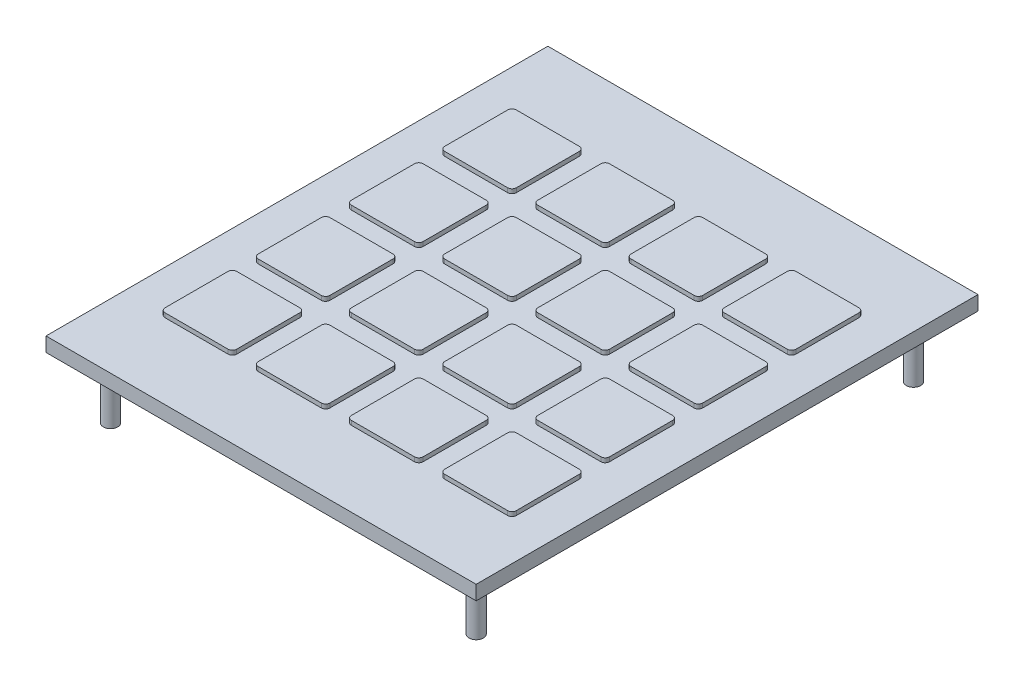
from build123d import *

# Parameters (mm, degrees)
SKETCH1_W           = 60
SKETCH1_H           = 70
BOSS_EXTRUDE1_DEPTH = 2
BOSS_EXTRUDE2_DEPTH = 0.6
SKETCH3_R           = 1
BOSS_EXTRUDE3_DEPTH = 8.5


with BuildPart() as part:
    # Sketch1 → Boss-Extrude1 (new body)
    with BuildSketch(Plane(origin=(0, 0, 0), x_dir=(1, 0, 0), z_dir=(0, 1, 0))):
        with Locations((0.12195122, -20.182926829)):
            Rectangle(SKETCH1_W, SKETCH1_H)
    extrude(amount=BOSS_EXTRUDE1_DEPTH)

    # Sketch2 → Boss-Extrude2 (add)
    with BuildSketch(Plane(origin=(0, 2, 0), x_dir=(1, 0, 0), z_dir=(0, 1, 0))):
        with BuildLine():
            Line((-23.77804878, 4.317073171), (-14.97804878, 4.317073171))
            ThreePointArc((-14.97804878, 4.317073171), (-14.553784712, 4.141337239), (-14.37804878, 3.717073171))
            Line((-14.37804878, 3.717073171), (-14.37804878, -5.082926829))
            ThreePointArc((-14.37804878, -5.082926829), (-14.553784712, -5.507190898), (-14.97804878, -5.682926829))
            Line((-14.97804878, -5.682926829), (-23.77804878, -5.682926829))
            ThreePointArc((-23.77804878, -5.682926829), (-24.202312849, -5.507190898), (-24.37804878, -5.082926829))
            Line((-24.37804878, -5.082926829), (-24.37804878, 3.717073171))
            ThreePointArc((-24.37804878, 3.717073171), (-24.202312849, 4.141337239), (-23.77804878, 4.317073171))
        make_face()
        with BuildLine():
            Line((-10.77804878, 4.317073171), (-1.97804878, 4.317073171))
            ThreePointArc((-1.97804878, 4.317073171), (-1.553784712, 4.141337239), (-1.37804878, 3.717073171))
            Line((-1.37804878, 3.717073171), (-1.37804878, -5.082926829))
            ThreePointArc((-1.37804878, -5.082926829), (-1.553784712, -5.507190898), (-1.97804878, -5.682926829))
            Line((-1.97804878, -5.682926829), (-10.77804878, -5.682926829))
            ThreePointArc((-10.77804878, -5.682926829), (-11.202312849, -5.507190898), (-11.37804878, -5.082926829))
            Line((-11.37804878, -5.082926829), (-11.37804878, 3.717073171))
            ThreePointArc((-11.37804878, 3.717073171), (-11.202312849, 4.141337239), (-10.77804878, 4.317073171))
        make_face()
        with BuildLine():
            Line((2.22195122, 4.317073171), (11.02195122, 4.317073171))
            ThreePointArc((11.02195122, 4.317073171), (11.446215288, 4.141337239), (11.62195122, 3.717073171))
            Line((11.62195122, 3.717073171), (11.62195122, -5.082926829))
            ThreePointArc((11.62195122, -5.082926829), (11.446215288, -5.507190898), (11.02195122, -5.682926829))
            Line((11.02195122, -5.682926829), (2.22195122, -5.682926829))
            ThreePointArc((2.22195122, -5.682926829), (1.797687151, -5.507190898), (1.62195122, -5.082926829))
            Line((1.62195122, -5.082926829), (1.62195122, 3.717073171))
            ThreePointArc((1.62195122, 3.717073171), (1.797687151, 4.141337239), (2.22195122, 4.317073171))
        make_face()
        with BuildLine():
            Line((15.22195122, 4.317073171), (24.02195122, 4.317073171))
            ThreePointArc((24.02195122, 4.317073171), (24.446215288, 4.141337239), (24.62195122, 3.717073171))
            Line((24.62195122, 3.717073171), (24.62195122, -5.082926829))
            ThreePointArc((24.62195122, -5.082926829), (24.446215288, -5.507190898), (24.02195122, -5.682926829))
            Line((24.02195122, -5.682926829), (15.22195122, -5.682926829))
            ThreePointArc((15.22195122, -5.682926829), (14.797687151, -5.507190898), (14.62195122, -5.082926829))
            Line((14.62195122, -5.082926829), (14.62195122, 3.717073171))
            ThreePointArc((14.62195122, 3.717073171), (14.797687151, 4.141337239), (15.22195122, 4.317073171))
        make_face()
        with BuildLine():
            Line((-10.77804878, -8.682926829), (-1.97804878, -8.682926829))
            ThreePointArc((-1.97804878, -8.682926829), (-1.553784712, -8.858662761), (-1.37804878, -9.282926829))
            Line((-1.37804878, -9.282926829), (-1.37804878, -18.082926829))
            ThreePointArc((-1.37804878, -18.082926829), (-1.553784712, -18.507190898), (-1.97804878, -18.682926829))
            Line((-1.97804878, -18.682926829), (-10.77804878, -18.682926829))
            ThreePointArc((-10.77804878, -18.682926829), (-11.202312849, -18.507190898), (-11.37804878, -18.082926829))
            Line((-11.37804878, -18.082926829), (-11.37804878, -9.282926829))
            ThreePointArc((-11.37804878, -9.282926829), (-11.202312849, -8.858662761), (-10.77804878, -8.682926829))
        make_face()
        with BuildLine():
            Line((2.22195122, -8.682926829), (11.02195122, -8.682926829))
            ThreePointArc((11.02195122, -8.682926829), (11.446215288, -8.858662761), (11.62195122, -9.282926829))
            Line((11.62195122, -9.282926829), (11.62195122, -18.082926829))
            ThreePointArc((11.62195122, -18.082926829), (11.446215288, -18.507190898), (11.02195122, -18.682926829))
            Line((11.02195122, -18.682926829), (2.22195122, -18.682926829))
            ThreePointArc((2.22195122, -18.682926829), (1.797687151, -18.507190898), (1.62195122, -18.082926829))
            Line((1.62195122, -18.082926829), (1.62195122, -9.282926829))
            ThreePointArc((1.62195122, -9.282926829), (1.797687151, -8.858662761), (2.22195122, -8.682926829))
        make_face()
        with BuildLine():
            Line((15.22195122, -8.682926829), (24.02195122, -8.682926829))
            ThreePointArc((24.02195122, -8.682926829), (24.446215288, -8.858662761), (24.62195122, -9.282926829))
            Line((24.62195122, -9.282926829), (24.62195122, -18.082926829))
            ThreePointArc((24.62195122, -18.082926829), (24.446215288, -18.507190898), (24.02195122, -18.682926829))
            Line((24.02195122, -18.682926829), (15.22195122, -18.682926829))
            ThreePointArc((15.22195122, -18.682926829), (14.797687151, -18.507190898), (14.62195122, -18.082926829))
            Line((14.62195122, -18.082926829), (14.62195122, -9.282926829))
            ThreePointArc((14.62195122, -9.282926829), (14.797687151, -8.858662761), (15.22195122, -8.682926829))
        make_face()
        with BuildLine():
            Line((-10.77804878, -21.682926829), (-1.97804878, -21.682926829))
            ThreePointArc((-1.97804878, -21.682926829), (-1.553784712, -21.858662761), (-1.37804878, -22.282926829))
            Line((-1.37804878, -22.282926829), (-1.37804878, -31.082926829))
            ThreePointArc((-1.37804878, -31.082926829), (-1.553784712, -31.507190898), (-1.97804878, -31.682926829))
            Line((-1.97804878, -31.682926829), (-10.77804878, -31.682926829))
            ThreePointArc((-10.77804878, -31.682926829), (-11.202312849, -31.507190898), (-11.37804878, -31.082926829))
            Line((-11.37804878, -31.082926829), (-11.37804878, -22.282926829))
            ThreePointArc((-11.37804878, -22.282926829), (-11.202312849, -21.858662761), (-10.77804878, -21.682926829))
        make_face()
        with BuildLine():
            Line((2.22195122, -21.682926829), (11.02195122, -21.682926829))
            ThreePointArc((11.02195122, -21.682926829), (11.446215288, -21.858662761), (11.62195122, -22.282926829))
            Line((11.62195122, -22.282926829), (11.62195122, -31.082926829))
            ThreePointArc((11.62195122, -31.082926829), (11.446215288, -31.507190898), (11.02195122, -31.682926829))
            Line((11.02195122, -31.682926829), (2.22195122, -31.682926829))
            ThreePointArc((2.22195122, -31.682926829), (1.797687151, -31.507190898), (1.62195122, -31.082926829))
            Line((1.62195122, -31.082926829), (1.62195122, -22.282926829))
            ThreePointArc((1.62195122, -22.282926829), (1.797687151, -21.858662761), (2.22195122, -21.682926829))
        make_face()
        with BuildLine():
            Line((15.22195122, -21.682926829), (24.02195122, -21.682926829))
            ThreePointArc((24.02195122, -21.682926829), (24.446215288, -21.858662761), (24.62195122, -22.282926829))
            Line((24.62195122, -22.282926829), (24.62195122, -31.082926829))
            ThreePointArc((24.62195122, -31.082926829), (24.446215288, -31.507190898), (24.02195122, -31.682926829))
            Line((24.02195122, -31.682926829), (15.22195122, -31.682926829))
            ThreePointArc((15.22195122, -31.682926829), (14.797687151, -31.507190898), (14.62195122, -31.082926829))
            Line((14.62195122, -31.082926829), (14.62195122, -22.282926829))
            ThreePointArc((14.62195122, -22.282926829), (14.797687151, -21.858662761), (15.22195122, -21.682926829))
        make_face()
        with BuildLine():
            Line((-10.77804878, -34.682926829), (-1.97804878, -34.682926829))
            ThreePointArc((-1.97804878, -34.682926829), (-1.553784712, -34.858662761), (-1.37804878, -35.282926829))
            Line((-1.37804878, -35.282926829), (-1.37804878, -44.082926829))
            ThreePointArc((-1.37804878, -44.082926829), (-1.553784712, -44.507190898), (-1.97804878, -44.682926829))
            Line((-1.97804878, -44.682926829), (-10.77804878, -44.682926829))
            ThreePointArc((-10.77804878, -44.682926829), (-11.202312849, -44.507190898), (-11.37804878, -44.082926829))
            Line((-11.37804878, -44.082926829), (-11.37804878, -35.282926829))
            ThreePointArc((-11.37804878, -35.282926829), (-11.202312849, -34.858662761), (-10.77804878, -34.682926829))
        make_face()
        with BuildLine():
            Line((2.22195122, -34.682926829), (11.02195122, -34.682926829))
            ThreePointArc((11.02195122, -34.682926829), (11.446215288, -34.858662761), (11.62195122, -35.282926829))
            Line((11.62195122, -35.282926829), (11.62195122, -44.082926829))
            ThreePointArc((11.62195122, -44.082926829), (11.446215288, -44.507190898), (11.02195122, -44.682926829))
            Line((11.02195122, -44.682926829), (2.22195122, -44.682926829))
            ThreePointArc((2.22195122, -44.682926829), (1.797687151, -44.507190898), (1.62195122, -44.082926829))
            Line((1.62195122, -44.082926829), (1.62195122, -35.282926829))
            ThreePointArc((1.62195122, -35.282926829), (1.797687151, -34.858662761), (2.22195122, -34.682926829))
        make_face()
        with BuildLine():
            Line((15.22195122, -34.682926829), (24.02195122, -34.682926829))
            ThreePointArc((24.02195122, -34.682926829), (24.446215288, -34.858662761), (24.62195122, -35.282926829))
            Line((24.62195122, -35.282926829), (24.62195122, -44.082926829))
            ThreePointArc((24.62195122, -44.082926829), (24.446215288, -44.507190898), (24.02195122, -44.682926829))
            Line((24.02195122, -44.682926829), (15.22195122, -44.682926829))
            ThreePointArc((15.22195122, -44.682926829), (14.797687151, -44.507190898), (14.62195122, -44.082926829))
            Line((14.62195122, -44.082926829), (14.62195122, -35.282926829))
            ThreePointArc((14.62195122, -35.282926829), (14.797687151, -34.858662761), (15.22195122, -34.682926829))
        make_face()
        with BuildLine():
            Line((-23.77804878, -8.682926829), (-14.97804878, -8.682926829))
            ThreePointArc((-14.97804878, -8.682926829), (-14.553784712, -8.858662761), (-14.37804878, -9.282926829))
            Line((-14.37804878, -9.282926829), (-14.37804878, -18.082926829))
            ThreePointArc((-14.37804878, -18.082926829), (-14.553784712, -18.507190898), (-14.97804878, -18.682926829))
            Line((-14.97804878, -18.682926829), (-23.77804878, -18.682926829))
            ThreePointArc((-23.77804878, -18.682926829), (-24.202312849, -18.507190898), (-24.37804878, -18.082926829))
            Line((-24.37804878, -18.082926829), (-24.37804878, -9.282926829))
            ThreePointArc((-24.37804878, -9.282926829), (-24.202312849, -8.858662761), (-23.77804878, -8.682926829))
        make_face()
        with BuildLine():
            Line((-23.77804878, -21.682926829), (-14.97804878, -21.682926829))
            ThreePointArc((-14.97804878, -21.682926829), (-14.553784712, -21.858662761), (-14.37804878, -22.282926829))
            Line((-14.37804878, -22.282926829), (-14.37804878, -31.082926829))
            ThreePointArc((-14.37804878, -31.082926829), (-14.553784712, -31.507190898), (-14.97804878, -31.682926829))
            Line((-14.97804878, -31.682926829), (-23.77804878, -31.682926829))
            ThreePointArc((-23.77804878, -31.682926829), (-24.202312849, -31.507190898), (-24.37804878, -31.082926829))
            Line((-24.37804878, -31.082926829), (-24.37804878, -22.282926829))
            ThreePointArc((-24.37804878, -22.282926829), (-24.202312849, -21.858662761), (-23.77804878, -21.682926829))
        make_face()
        with BuildLine():
            Line((-23.77804878, -34.682926829), (-14.97804878, -34.682926829))
            ThreePointArc((-14.97804878, -34.682926829), (-14.553784712, -34.858662761), (-14.37804878, -35.282926829))
            Line((-14.37804878, -35.282926829), (-14.37804878, -44.082926829))
            ThreePointArc((-14.37804878, -44.082926829), (-14.553784712, -44.507190898), (-14.97804878, -44.682926829))
            Line((-14.97804878, -44.682926829), (-23.77804878, -44.682926829))
            ThreePointArc((-23.77804878, -44.682926829), (-24.202312849, -44.507190898), (-24.37804878, -44.082926829))
            Line((-24.37804878, -44.082926829), (-24.37804878, -35.282926829))
            ThreePointArc((-24.37804878, -35.282926829), (-24.202312849, -34.858662761), (-23.77804878, -34.682926829))
        make_face()
    extrude(amount=BOSS_EXTRUDE2_DEPTH)

    # Sketch3 → Boss-Extrude3 (add)
    with BuildSketch(Plane.XZ):
        with Locations(Location((25.62195122, -10.317073171, 0), (0, 0, 90))):
            Circle(SKETCH3_R)
        with Locations(Location((-25.37804878, -10.317073171, 0), (0, 0, 90))):
            Circle(SKETCH3_R)
        with Locations(Location((25.62195122, 50.682926829, 0), (0, 0, 90))):
            Circle(SKETCH3_R)
        with Locations(Location((-25.37804878, 50.682926829, 0), (0, 0, 90))):
            Circle(SKETCH3_R)
    extrude(amount=BOSS_EXTRUDE3_DEPTH)


solid = part.part
